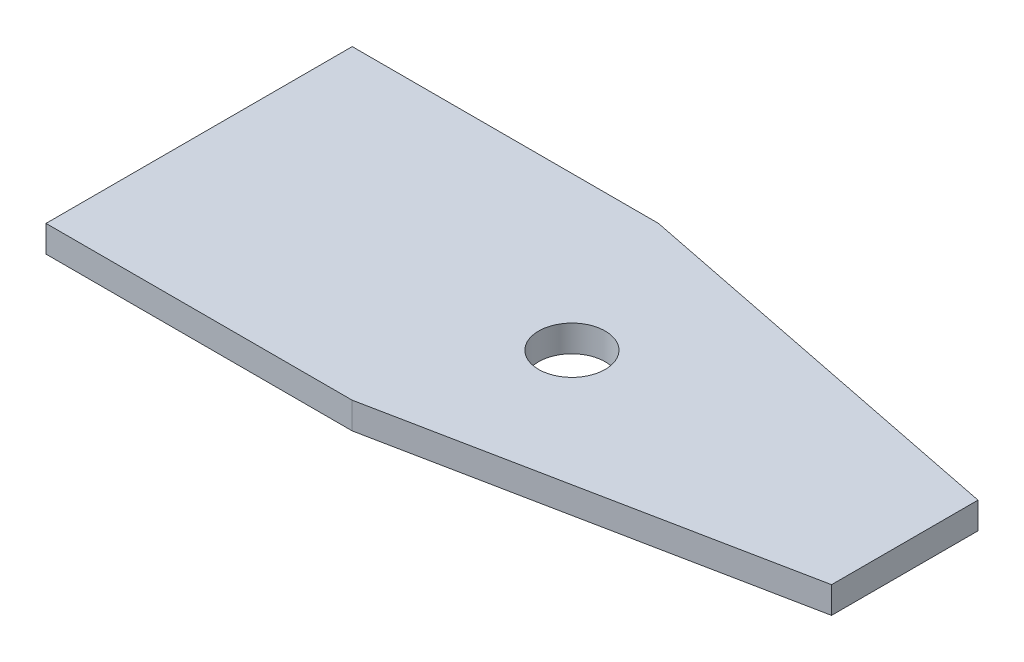
from build123d import *

# Parameters (mm, degrees)
SKETCH_1_W          = 53
SKETCH_1_H          = 23
SKETCH_1_R          = 2.5
EXTRUDE_1_DEPTH     = 2
CUT_EXTRUDE_1_DEPTH = 2


with BuildPart() as part:
    # 草图1 → 凸台-拉伸1 (new body)
    with BuildSketch(Plane(origin=(0, 0, 0), x_dir=(1, 0, 0), z_dir=(0, 1, 0))):
        with Locations((26.5, 11.5)):
            Rectangle(SKETCH_1_W, SKETCH_1_H)
        with Locations(Location((28, 11.5, 0), (0, 0, 270))):
            Circle(SKETCH_1_R, mode=Mode.SUBTRACT)
    extrude(amount=EXTRUDE_1_DEPTH)

    # 草图2 → 切除-拉伸1 (cut)
    with BuildSketch(Plane(origin=(0, 2, 0), x_dir=(1, 0, 0), z_dir=(0, 1, 0))):
        Polygon((53, 23), (53, 17), (23, 23), align=None)
        Polygon((23, 0), (53, 6), (53, 0), align=None)
    extrude(amount=-CUT_EXTRUDE_1_DEPTH, mode=Mode.SUBTRACT)


solid = part.part
